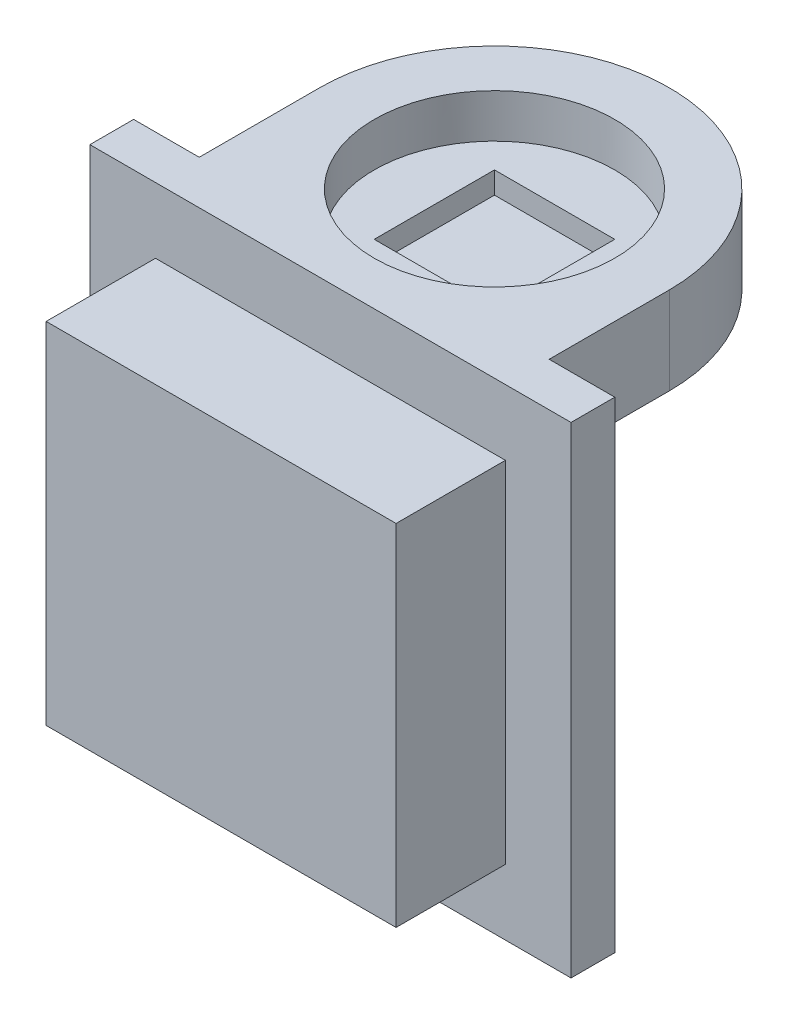
from build123d import *

# Parameters (mm, degrees)
SKETCH1_W             = 16
SKETCH1_H             = 16
FRONT_OF_SWITCH_DEPTH = 1.5
SKETCH2_W             = 16
SKETCH2_H             = 16
SKETCH2_W_2           = 14
SKETCH2_H_2           = 14
SIDES_OF_SWITCH_DEPTH = 3.5
SKETCH3_W             = 22
SKETCH3_H             = 22
SKETCH3_W_2           = 14
SKETCH3_H_2           = 14
BOSS_EXTRUDE3_DEPTH   = 2
SKETCH4_R             = 5.5
BOSS_EXTRUDE4_DEPTH   = 4
BOSS_EXTRUDE5_START   = -2
SKETCH5_R             = 5.5
SKETCH5_W             = 5.5
SKETCH5_H             = 5.5
BOSS_EXTRUDE5_DEPTH   = 2
SKETCH6_W             = 5.5
SKETCH6_H             = 5.5
BOSS_EXTRUDE6_DEPTH   = 1


with BuildPart() as part:
    # Sketch1 → Front of switch (new body)
    with BuildSketch(Plane.XY):
        Rectangle(SKETCH1_W, SKETCH1_H)
    extrude(amount=FRONT_OF_SWITCH_DEPTH)

    # Sketch2 → Sides of switch (add)
    with BuildSketch(Plane(origin=(0, 0, 0), x_dir=(-1, 0, 0), z_dir=(0, 0, -1))):
        Rectangle(SKETCH2_W, SKETCH2_H)
        Rectangle(SKETCH2_W_2, SKETCH2_H_2, mode=Mode.SUBTRACT)
    extrude(amount=SIDES_OF_SWITCH_DEPTH)

    # Sketch3 → Boss-Extrude3 (add)
    with BuildSketch(Plane(origin=(0, 0, -3.5), x_dir=(-1, 0, 0), z_dir=(0, 0, -1))):
        Rectangle(SKETCH3_W, SKETCH3_H)
        Rectangle(SKETCH3_W_2, SKETCH3_H_2, mode=Mode.SUBTRACT)
    extrude(amount=BOSS_EXTRUDE3_DEPTH)

    # Sketch4 → Boss-Extrude4 (add)
    with BuildSketch(Plane(origin=(0, 11, 0), x_dir=(1, 0, 0), z_dir=(0, 1, 0))):
        with BuildLine():
            Line((-8, 5.5), (-8, 11))
            ThreePointArc((-8, 11), (0, 19), (8, 11))
            Line((8, 11), (8, 5.5))
            Line((8, 5.5), (8, 3.5))
            Line((8, 3.5), (-8, 3.5))
            Line((-8, 3.5), (-8, 5.5))
        make_face()
        with Locations(Location((0, 11, 0), (0, 0, 270))):
            Circle(SKETCH4_R, mode=Mode.SUBTRACT)
    extrude(amount=-BOSS_EXTRUDE4_DEPTH)

    # Sketch5 → Boss-Extrude5 (add)
    with BuildSketch(Plane.XZ.offset(-7).offset(BOSS_EXTRUDE5_START)):
        with Locations(Location((0, -11, 0), (0, 0, 90))):
            Circle(SKETCH5_R)
        with Locations((0, -11)):
            Rectangle(SKETCH5_W, SKETCH5_H, mode=Mode.SUBTRACT)
    extrude(amount=BOSS_EXTRUDE5_DEPTH)

    # Sketch6 → Boss-Extrude6 (add)
    with BuildSketch(Plane.XZ.offset(-7)):
        with Locations((0, -11)):
            Rectangle(SKETCH6_W, SKETCH6_H)
    extrude(amount=-BOSS_EXTRUDE6_DEPTH)


solid = part.part
